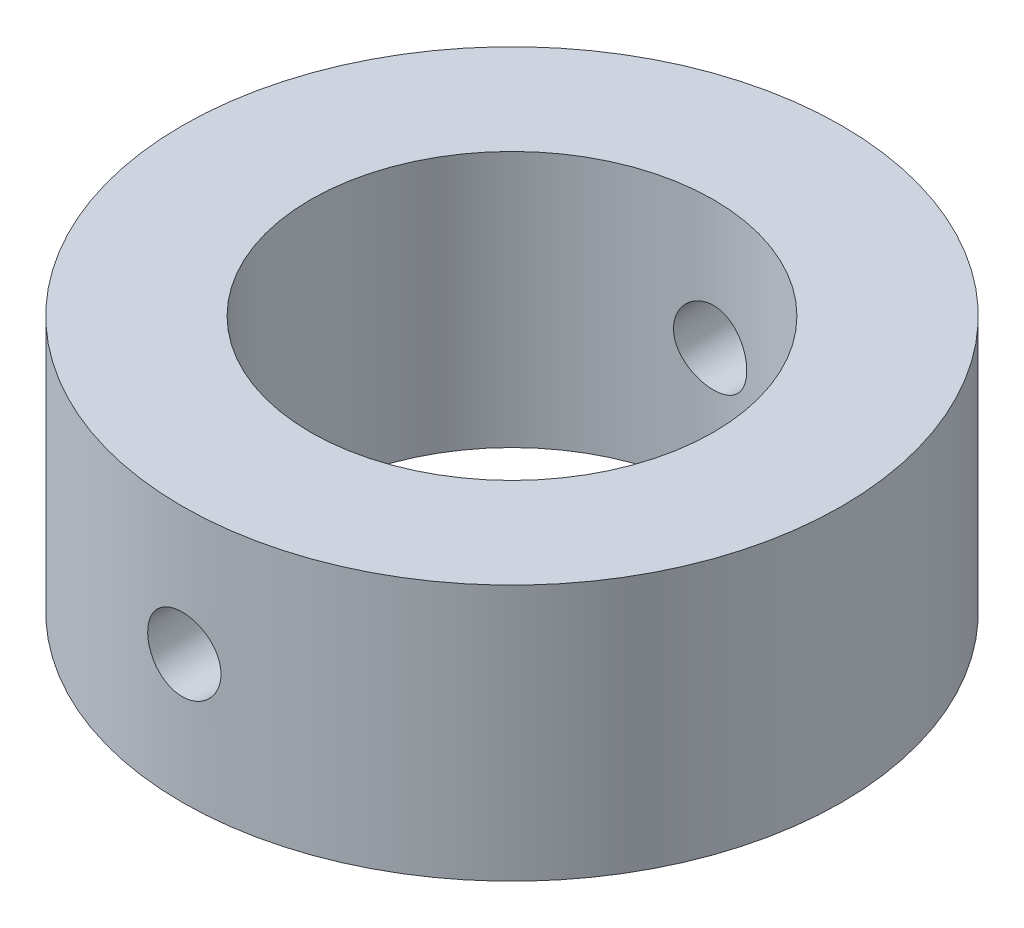
from build123d import *

# Parameters (mm, degrees)
SKETCH2_R               = 18
SKETCH2_R_2             = 11
BOSS_EXTRUDE1_DEPTH     = 14
CUT_EXTRUDE1_DEPTH      = 30.051678093
CUT_EXTRUDE1_DEPTH_BACK = 30.051678093
SKETCH3_R               = 2


with BuildPart() as part:
    # Sketch2 → Boss-Extrude1 (new body)
    with BuildSketch(Plane(origin=(0, 0, 0), x_dir=(1, 0, 0), z_dir=(0, 1, 0))):
        with Locations(Location((0, 0, 0), (0, 0, 270))):
            Circle(SKETCH2_R)
        with Locations(Location((0, 0, 0), (0, 0, 270))):
            Circle(SKETCH2_R_2, mode=Mode.SUBTRACT)
    extrude(amount=BOSS_EXTRUDE1_DEPTH)

    # Sketch3 → Cut-Extrude1 (cut, two sides: drawn at the far end of the back side and taken through both)
    with BuildSketch(Plane.XY.offset(-CUT_EXTRUDE1_DEPTH_BACK)):
        with Locations((0, 7)):
            Circle(SKETCH3_R)
    extrude(amount=CUT_EXTRUDE1_DEPTH + CUT_EXTRUDE1_DEPTH_BACK, mode=Mode.SUBTRACT)


solid = part.part
